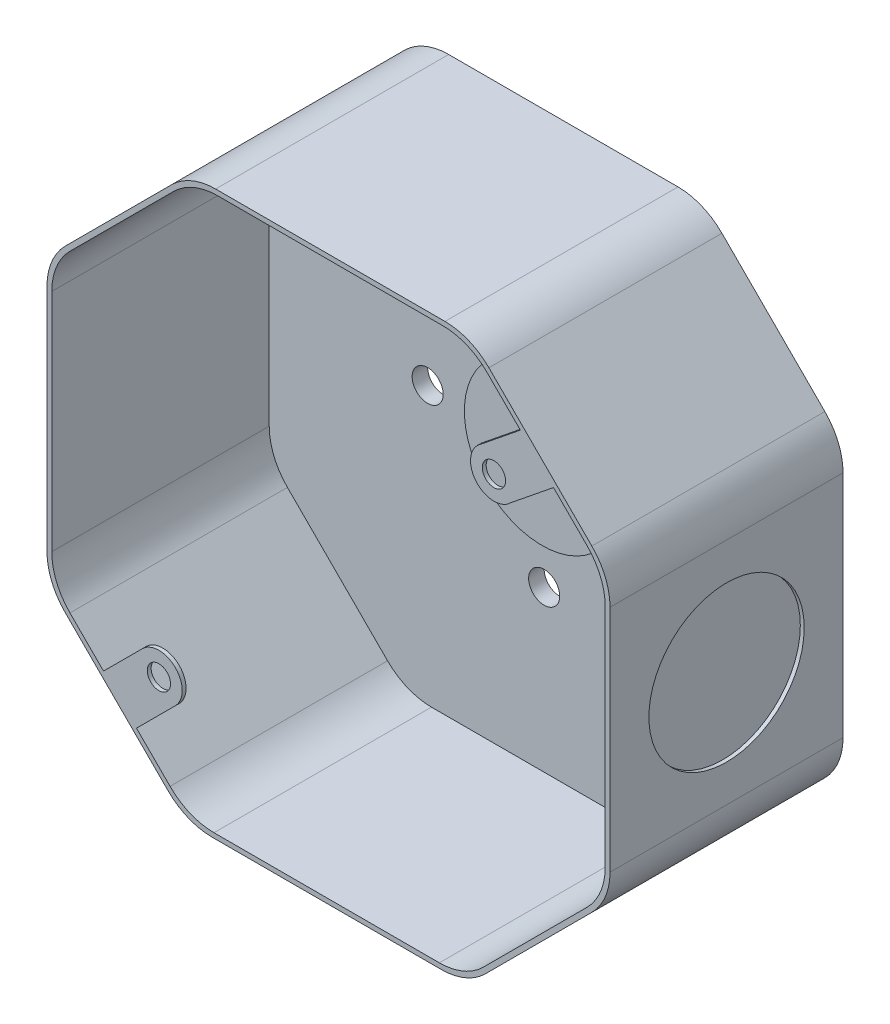
from build123d import *

# Parameters (mm, degrees)
BOSS_EXTRUDE1_DEPTH     = 38.1
CUT_EXTRUDE1_DEPTH      = 35.56
CUT_EXTRUDE9_DEPTH      = 110.891333521
CUT_EXTRUDE9_DEPTH_BACK = 110.891333521
SKETCH20_R              = 2.54
BOSS_EXTRUDE2_DEPTH     = 0.635
SKETCH9_R               = 1.905
CUT_EXTRUDE4_DEPTH      = 3.175
BOSS_EXTRUDE3_DEPTH     = 0.635
SKETCH12_R              = 1.905
CUT_EXTRUDE5_DEPTH      = 0.635
SKETCH13_R              = 12.7
BOSS_EXTRUDE4_DEPTH     = 0.635
SKETCH14_R              = 12.7
CUT_EXTRUDE6_DEPTH      = 0.635
SKETCH15_R              = 12.7
CUT_EXTRUDE7_DEPTH      = 0.635
SKETCH16_R              = 12.7
CUT_EXTRUDE8_DEPTH      = 0.635
FILLET1_R               = 10.16
FILLET2_R               = 10.16


with BuildPart() as part:
    # Sketch3 → Boss-Extrude1 (new body)
    with BuildSketch(Plane.XY):
        Polygon((-22.959817584, 0), (22.959817584, 0), (46.332381312, 23.372563728), (46.332381312, 69.294099898), (23.55148121, 92.075), (-22.368153958, 92.075), (-45.740717686, 68.702436272), (-45.740717686, 22.780900102), align=None)
    extrude(amount=BOSS_EXTRUDE1_DEPTH)

    # Sketch4 → Cut-Extrude1 (cut)
    with BuildSketch(Plane.XY.offset(38.1)):
        Polygon((23.225329451, 91.2876), (-22.042002199, 91.2876), (-44.953317686, 68.376284513), (-44.953317686, 23.107051861), (-22.633665825, 0.7874), (22.633665825, 0.7874), (45.544981312, 23.698715487), (45.544981312, 68.967948139), align=None)
    extrude(amount=-CUT_EXTRUDE1_DEPTH, mode=Mode.SUBTRACT)

    # Sketch20 → Cut-Extrude9 (cut, two sides: drawn at the far end of the back side and taken through both)
    with BuildSketch(Plane.XY.offset(-CUT_EXTRUDE9_DEPTH_BACK)):
        with Locations((0, 65.0748)):
            Circle(SKETCH20_R)
        with Locations((19.05, 46.0248)):
            Circle(SKETCH20_R)
        with Locations((0, 26.9748)):
            Circle(SKETCH20_R)
        with Locations((-19.05, 46.0248)):
            Circle(SKETCH20_R)
    extrude(amount=CUT_EXTRUDE9_DEPTH + CUT_EXTRUDE9_DEPTH_BACK, mode=Mode.SUBTRACT)

    # Sketch8 → Boss-Extrude2 (add)
    with BuildSketch(Plane.XY.offset(38.1)):
        with BuildLine():
            Line((24.678794584, 77.195818088), (32.28681384, 83.33966737))
            Line((32.28681384, 83.33966737), (37.705421486, 77.921059725))
            Line((37.705421486, 77.921059725), (30.09740223, 71.777210443))
            ThreePointArc((30.09740223, 71.777210443), (24.639652924, 71.738068783), (24.678794584, 77.195818088))
        make_face()
    extrude(amount=-BOSS_EXTRUDE2_DEPTH)

    # Sketch9 → Cut-Extrude4 (cut)
    with BuildSketch(Plane.XY.offset(38.1)):
        with Locations((27.349235463, 74.447651321)):
            Circle(SKETCH9_R)
    extrude(amount=-CUT_EXTRUDE4_DEPTH, mode=Mode.SUBTRACT)

    # Sketch11 → Boss-Extrude3 (add)
    with BuildSketch(Plane.XY.offset(38.1)):
        with BuildLine():
            Line((-37.044344471, 14.084526887), (-30.129547258, 20.9993241))
            ThreePointArc((-30.129547258, 20.9993241), (-24.741393586, 20.9993241), (-24.741393586, 15.611170428))
            Line((-24.741393586, 15.611170428), (-31.656190799, 8.696373215))
            Line((-31.656190799, 8.696373215), (-37.044344471, 14.084526887))
        make_face()
    extrude(amount=-BOSS_EXTRUDE3_DEPTH)

    # Sketch12 → Cut-Extrude5 (cut)
    with BuildSketch(Plane.XY.offset(38.1)):
        with Locations((-27.435470422, 18.305247264)):
            Circle(SKETCH12_R)
    extrude(amount=-CUT_EXTRUDE5_DEPTH, mode=Mode.SUBTRACT)

    # Sketch13 → Boss-Extrude4 (add)
    with BuildSketch(Plane.XY.offset(2.54)):
        with Locations((0.284082314, 46.0502)):
            Circle(SKETCH13_R)
    extrude(amount=BOSS_EXTRUDE4_DEPTH)

    # Sketch14 → Cut-Extrude6 (cut)
    with BuildSketch(Plane(origin=(46.332381312, 0, 0), x_dir=(0, 0, -1), z_dir=(1, 0, 0))):
        with Locations((-19.05, 46.334163728)):
            Circle(SKETCH14_R)
    extrude(amount=-CUT_EXTRUDE6_DEPTH, mode=Mode.SUBTRACT)

    # Sketch15 → Cut-Extrude7 (cut)
    with BuildSketch(Plane.ZY.offset(45.740717686)):
        with Locations((19.05, 45.742500102)):
            Circle(SKETCH15_R)
    extrude(amount=-CUT_EXTRUDE7_DEPTH, mode=Mode.SUBTRACT)

    # Sketch16 → Cut-Extrude8 (cut)
    with BuildSketch(Plane.XZ):
        with Locations((0, 19.05)):
            Circle(SKETCH16_R)
    extrude(amount=-CUT_EXTRUDE8_DEPTH, mode=Mode.SUBTRACT)

    # Fillet1
    fillet1_edges = [part.edges().sort_by_distance(p)[0] for p in [
        (46.332381312, 23.372563728, 19.05),
        (22.959817584, 0, 19.05),
        (-22.959817584, 0, 19.05),
        (-45.740717686, 22.780900102, 19.05),
        (-45.740717686, 68.702436272, 19.05),
        (-22.368153958, 92.075, 19.05),
        (23.55148121, 92.075, 19.05),
        (46.332381312, 69.294099898, 19.05),
    ]]
    fillet(fillet1_edges, radius=FILLET1_R)

    # Fillet2
    fillet2_edges = [part.edges().sort_by_distance(p)[0] for p in [
        (22.633665825, 0.7874, 20.32),
        (-44.953317686, 68.376284513, 20.32),
        (-44.953317686, 23.107051861, 20.32),
        (-22.633665825, 0.7874, 20.32),
        (45.544981312, 23.698715487, 20.32),
        (45.544981312, 68.967948139, 20.32),
        (23.225329451, 91.2876, 20.32),
        (-22.042002199, 91.2876, 20.32),
    ]]
    fillet(fillet2_edges, radius=FILLET2_R)


solid = part.part
